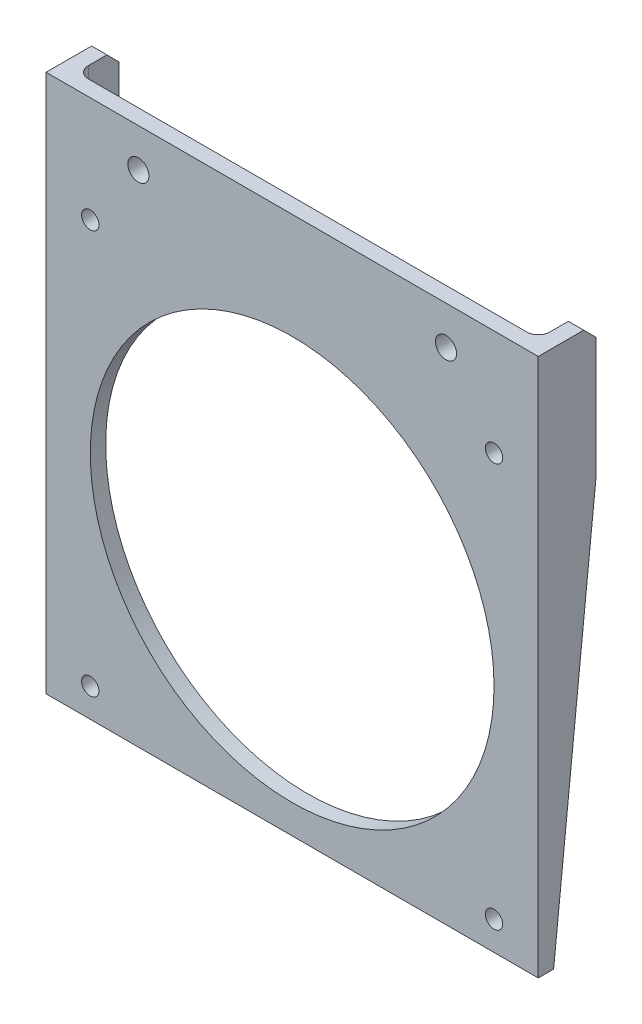
from build123d import *

# Parameters (mm, degrees)
SKETCH1_W            = 120
SKETCH1_H            = 140
SKETCH1_R            = 52.5
BOSS_EXTRUDE1_DEPTH  = 4
M4_CLEARANCE_HOLE1_D = 4.5
M5_CLEARANCE_HOLE1_D = 5.5
BOSS_EXTRUDE2_DEPTH  = 4
FILLET1_R            = 3


with BuildPart() as part:
    # Sketch1 → Boss-Extrude1 (new body)
    with BuildSketch(Plane.XY):
        with Locations((60, 70)):
            Rectangle(SKETCH1_W, SKETCH1_H)
        with Locations((60, 60)):
            Circle(SKETCH1_R, mode=Mode.SUBTRACT)
    extrude(amount=BOSS_EXTRUDE1_DEPTH)

    # M4 Clearance Hole1 (through all)
    with Locations(Plane.XY.offset(4)):
        with Locations((7.5, 7.5), (60, 60), (7.5, 112.5), (112.5, 112.5), (112.5, 7.5)):
            Hole(M4_CLEARANCE_HOLE1_D / 2)

    # M5 Clearance Hole1 (through all)
    with Locations(Plane.XY.offset(4)):
        with Locations((100, 130), (20, 130)):
            Hole(M5_CLEARANCE_HOLE1_D / 2)

    # Sketch6 → Boss-Extrude2 (add)
    with BuildSketch(Plane(origin=(120, 0, 0), x_dir=(0, 0, -1), z_dir=(1, 0, 0))):
        Polygon((-4, 140), (7.829119834, 140), (11, 136.829119834), (11, 105), (0, 0), (-4, 0), align=None)
    boss_extrude2 = extrude(amount=BOSS_EXTRUDE2_DEPTH)

    # Mirror1: Boss-Extrude2 across plane
    add(boss_extrude2.mirror(Plane.ZY.offset(-60)))

    # Fillet1
    fillet1_edges = [part.edges().sort_by_distance(p)[0] for p in [
        (120, 70, 0),
        (0, 70, 0),
    ]]
    fillet(fillet1_edges, radius=FILLET1_R)


solid = part.part
